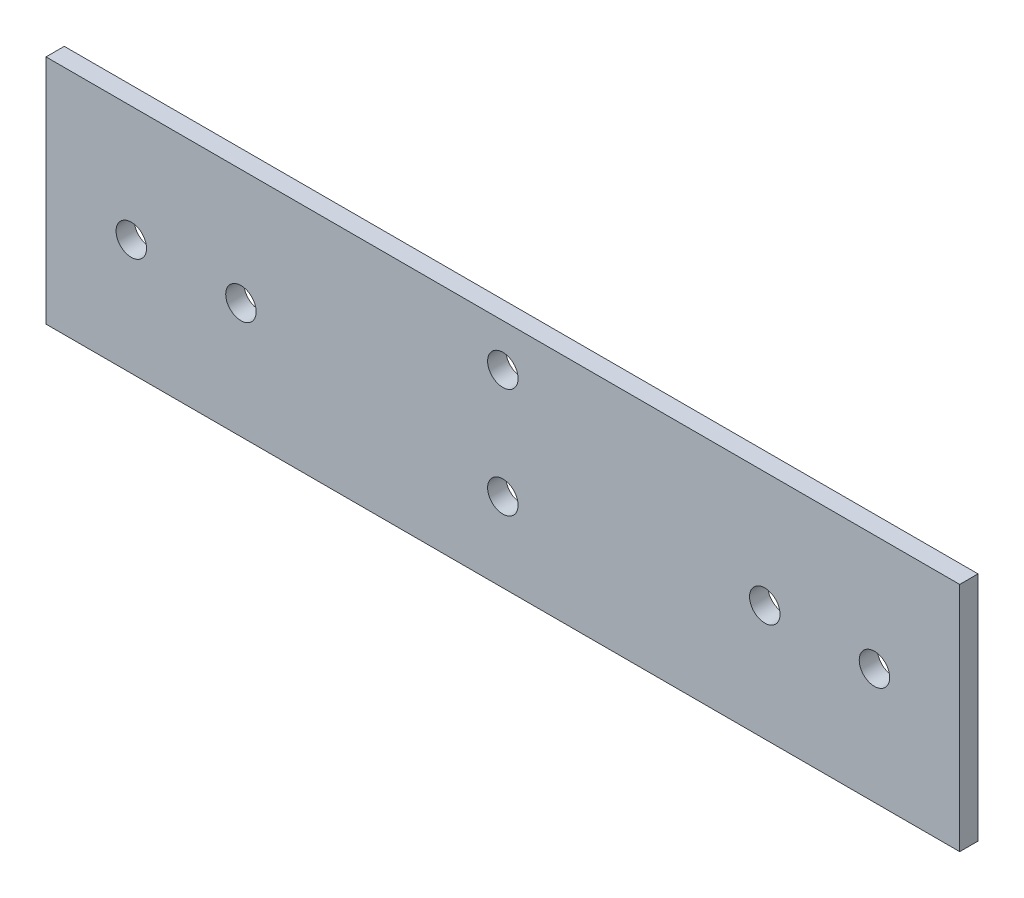
from build123d import *

# Parameters (mm, degrees)
SKETCH_1_W          = 150
SKETCH_1_H          = 38
EXTRUDE_1_DEPTH     = 3
CUT_EXTRUDE_1_REACH = 79.427
SKETCH_2_R          = 2.5
CUT_EXTRUDE_2_REACH = 79.427
SKETCH_4_R          = 2.5


with BuildPart() as part:
    # 草圖1 → 填料-伸長1 (new body)
    with BuildSketch(Plane.XY):
        Rectangle(SKETCH_1_W, SKETCH_1_H)
    extrude(amount=EXTRUDE_1_DEPTH)

    # 草圖2 → 除料-伸長1 (cut, up to next)
    with BuildSketch(Plane(origin=(0, 0, 0), x_dir=(-1, 0, 0), z_dir=(0, 0, -1)), mode=Mode.PRIVATE) as cut_extrude_1_sk1:
        with Locations((-61, 0)):
            Circle(SKETCH_2_R)
    cut_extrude_1_tool1 = extrude(cut_extrude_1_sk1.sketch, amount=-CUT_EXTRUDE_1_REACH, mode=Mode.PRIVATE) & part.part
    # 草圖2 → 除料-伸長1 (cut, up to next)
    with BuildSketch(Plane(origin=(0, 0, 0), x_dir=(-1, 0, 0), z_dir=(0, 0, -1)), mode=Mode.PRIVATE) as cut_extrude_1_sk2:
        with Locations((-43, 0)):
            Circle(SKETCH_2_R)
    cut_extrude_1_tool2 = extrude(cut_extrude_1_sk2.sketch, amount=-CUT_EXTRUDE_1_REACH, mode=Mode.PRIVATE) & part.part
    cut_extrude_1_1 = cut_extrude_1_tool1.solids().sort_by_distance((61, 0, 0))[0]
    add(cut_extrude_1_1, mode=Mode.SUBTRACT)
    cut_extrude_1_2 = cut_extrude_1_tool2.solids().sort_by_distance((43, 0, 0))[0]
    add(cut_extrude_1_2, mode=Mode.SUBTRACT)
    cut_extrude_1 = cut_extrude_1_1 + cut_extrude_1_2  # 除料-伸長1 as one shape, for the pattern or mirror that repeats it

    # 鏡射1: 除料-伸長1 across plane
    add(cut_extrude_1.mirror(Plane(origin=(0, 0, 0), x_dir=(0, 0, 1), z_dir=(1, 0, 0))), mode=Mode.SUBTRACT)

    # 草圖4 → 除料-伸長2 (cut, up to next)
    with BuildSketch(Plane(origin=(0, 0, 0), x_dir=(-1, 0, 0), z_dir=(0, 0, -1)), mode=Mode.PRIVATE) as cut_extrude_2_sk1:
        with Locations((0, -6)):
            Circle(SKETCH_4_R)
    cut_extrude_2_tool1 = extrude(cut_extrude_2_sk1.sketch, amount=-CUT_EXTRUDE_2_REACH, mode=Mode.PRIVATE) & part.part
    # 草圖4 → 除料-伸長2 (cut, up to next)
    with BuildSketch(Plane(origin=(0, 0, 0), x_dir=(-1, 0, 0), z_dir=(0, 0, -1)), mode=Mode.PRIVATE) as cut_extrude_2_sk2:
        with Locations((0, 12)):
            Circle(SKETCH_4_R)
    cut_extrude_2_tool2 = extrude(cut_extrude_2_sk2.sketch, amount=-CUT_EXTRUDE_2_REACH, mode=Mode.PRIVATE) & part.part
    add(cut_extrude_2_tool1.solids().sort_by_distance((0, -6, 0))[0], mode=Mode.SUBTRACT)
    add(cut_extrude_2_tool2.solids().sort_by_distance((0, 12, 0))[0], mode=Mode.SUBTRACT)


solid = part.part
